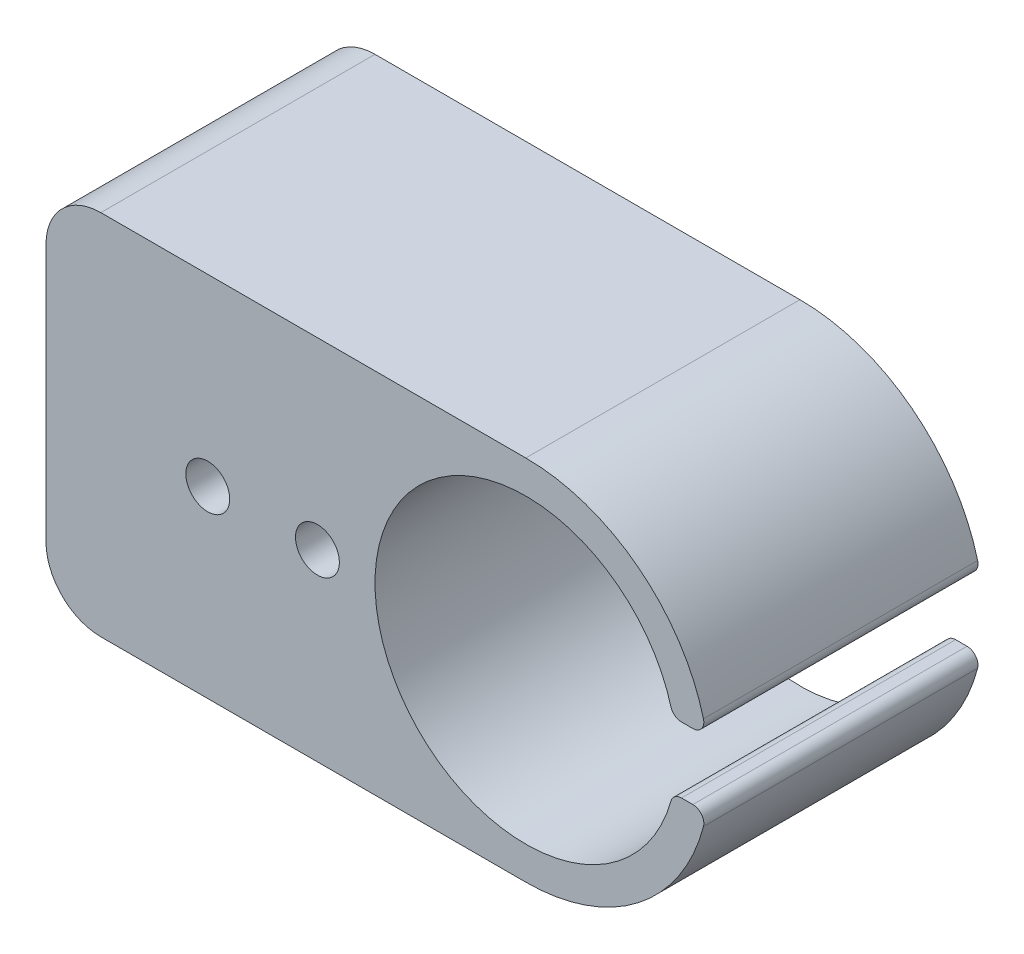
from build123d import *

# Parameters (mm, degrees)
ESQUISSE1_R             = 2
BOSS_EXTRU_1_DEPTH      = 25
ESQUISSE5_R             = 2
ENL_V_MAT_EXTRU_2_DEPTH = 10
CONG_1_R                = 5
CONG_2_R                = 1


with BuildPart() as part:
    # Esquisse1 → Boss.-Extru.1 (new body)
    with BuildSketch(Plane.XY):
        with BuildLine():
            Line((13.4187369, 3), (16.479153498, 3))
            ThreePointArc((16.479153498, 3), (10.731088016, 12.861036117), (0, 16.75))
            Line((0, 16.75), (-43.75, 16.75))
            Line((-43.75, 16.75), (-43.75, -16.75))
            Line((-43.75, -16.75), (0, -16.75))
            ThreePointArc((0, -16.75), (10.731088016, -12.861036117), (16.479153498, -3))
            Line((16.479153498, -3), (13.4187369, -3))
            ThreePointArc((13.4187369, -3), (-13.75, 0), (13.4187369, 3))
        make_face()
        with Locations((-29, 0)):
            Circle(ESQUISSE1_R, mode=Mode.SUBTRACT)
        with Locations((-19, 0)):
            Circle(ESQUISSE1_R, mode=Mode.SUBTRACT)
    extrude(amount=BOSS_EXTRU_1_DEPTH)

    # Esquisse5 → Enlèv. mat.-Extru.2 (cut)
    with BuildSketch(Plane.ZY.offset(43.75)):
        with Locations((7.5, 0)):
            Circle(ESQUISSE5_R)
        with Locations((17.5, 0)):
            Circle(ESQUISSE5_R)
    extrude(amount=-ENL_V_MAT_EXTRU_2_DEPTH, mode=Mode.SUBTRACT)

    # Congé1
    cong_1_edges = [part.edges().sort_by_distance(p)[0] for p in [
        (-43.75, -16.75, 12.5),
        (-43.75, 16.75, 12.5),
    ]]
    fillet(cong_1_edges, radius=CONG_1_R)

    # Congé2
    cong_2_edges = [part.edges().sort_by_distance(p)[0] for p in [
        (13.4187369, -3, 12.5),
        (16.479153498, -3, 12.5),
        (16.479153498, 3, 12.5),
        (13.4187369, 3, 12.5),
    ]]
    fillet(cong_2_edges, radius=CONG_2_R)


solid = part.part
